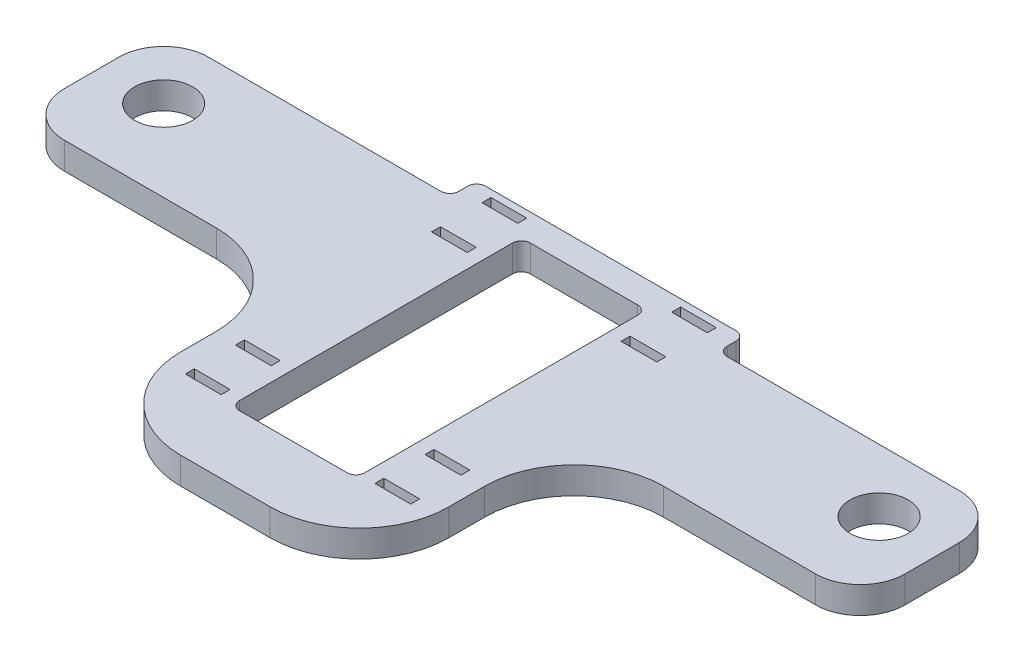
from build123d import *

# Parameters (mm, degrees)
SKETCH1_R           = 3.25
SKETCH1_W           = 14
SKETCH1_H           = 32.5
BOSS_EXTRUDE1_DEPTH = 3
FILLET1_R           = 10
FILLET2_R           = 1
FILLET3_R           = 5
CUT_EXTRUDE1_REACH  = 65.841
SKETCH2_W           = 4
SKETCH2_H           = 1


with BuildPart() as part:
    # Sketch1 → Boss-Extrude1 (new body)
    with BuildSketch(Plane(origin=(0, 0, 0), x_dir=(1, 0, 0), z_dir=(0, 1, 0))):
        Polygon((-47, 40.1), (-15, 40.1), (-15, 43.1), (15, 43.1), (15, 40.1), (47, 40.1), (47, 24), (15, 24), (15, 0), (-15, 0), (-15, 24), (-47, 24), align=None)
        with Locations(Location((40, 33.1, 0), (0, 0, 270))):
            Circle(SKETCH1_R, mode=Mode.SUBTRACT)
        with Locations(Location((-40, 33.1, 0), (0, 0, 90))):
            Circle(SKETCH1_R, mode=Mode.SUBTRACT)
        with Locations((0, 23.85)):
            Rectangle(SKETCH1_W, SKETCH1_H, mode=Mode.SUBTRACT)
    extrude(amount=BOSS_EXTRUDE1_DEPTH)

    # Fillet1
    fillet1_edges = [part.edges().sort_by_distance(p)[0] for p in [
        (-15, 1.5, -24),
        (15, 1.5, -24),
        (15, 1.5, 0),
        (-15, 1.5, 0),
    ]]
    fillet(fillet1_edges, radius=FILLET1_R)

    # Fillet2
    fillet2_edges = [part.edges().sort_by_distance(p)[0] for p in [
        (-15, 1.5, -40.1),
        (-15, 1.5, -43.1),
        (15, 1.5, -43.1),
        (15, 1.5, -40.1),
        (-7, 1.5, -40.1),
        (-7, 1.5, -7.6),
        (7, 1.5, -7.6),
        (7, 1.5, -40.1),
    ]]
    fillet(fillet2_edges, radius=FILLET2_R)

    # Fillet3
    fillet3_edges = [part.edges().sort_by_distance(p)[0] for p in [
        (-47, 1.5, -24),
        (-47, 1.5, -40.1),
        (47, 1.5, -40.1),
        (47, 1.5, -24),
    ]]
    fillet(fillet3_edges, radius=FILLET3_R)

    # Sketch2 → Cut-Extrude1 (cut, up to next)
    with BuildSketch(Plane(origin=(0, 3, 0), x_dir=(1, 0, 0), z_dir=(0, 1, 0)), mode=Mode.PRIVATE) as cut_extrude1_sk1:
        with Locations((10.6, 14.225)):
            Rectangle(SKETCH2_W, SKETCH2_H)
    cut_extrude1_tool1 = extrude(cut_extrude1_sk1.sketch, amount=-CUT_EXTRUDE1_REACH, mode=Mode.PRIVATE) & part.part
    # Sketch2 → Cut-Extrude1 (cut, up to next)
    with BuildSketch(Plane(origin=(0, 3, 0), x_dir=(1, 0, 0), z_dir=(0, 1, 0)), mode=Mode.PRIVATE) as cut_extrude1_sk2:
        with Locations((10.6, 41.8)):
            Rectangle(SKETCH2_W, SKETCH2_H)
    cut_extrude1_tool2 = extrude(cut_extrude1_sk2.sketch, amount=-CUT_EXTRUDE1_REACH, mode=Mode.PRIVATE) & part.part
    # Sketch2 → Cut-Extrude1 (cut, up to next)
    with BuildSketch(Plane(origin=(0, 3, 0), x_dir=(1, 0, 0), z_dir=(0, 1, 0)), mode=Mode.PRIVATE) as cut_extrude1_sk3:
        with Locations((-10.6, 41.8)):
            Rectangle(SKETCH2_W, SKETCH2_H)
    cut_extrude1_tool3 = extrude(cut_extrude1_sk3.sketch, amount=-CUT_EXTRUDE1_REACH, mode=Mode.PRIVATE) & part.part
    # Sketch2 → Cut-Extrude1 (cut, up to next)
    with BuildSketch(Plane(origin=(0, 3, 0), x_dir=(1, 0, 0), z_dir=(0, 1, 0)), mode=Mode.PRIVATE) as cut_extrude1_sk4:
        with Locations((-10.6, 36.15)):
            Rectangle(SKETCH2_W, SKETCH2_H)
    cut_extrude1_tool4 = extrude(cut_extrude1_sk4.sketch, amount=-CUT_EXTRUDE1_REACH, mode=Mode.PRIVATE) & part.part
    # Sketch2 → Cut-Extrude1 (cut, up to next)
    with BuildSketch(Plane(origin=(0, 3, 0), x_dir=(1, 0, 0), z_dir=(0, 1, 0)), mode=Mode.PRIVATE) as cut_extrude1_sk5:
        with Locations((10.6, 36.15)):
            Rectangle(SKETCH2_W, SKETCH2_H)
    cut_extrude1_tool5 = extrude(cut_extrude1_sk5.sketch, amount=-CUT_EXTRUDE1_REACH, mode=Mode.PRIVATE) & part.part
    # Sketch2 → Cut-Extrude1 (cut, up to next)
    with BuildSketch(Plane(origin=(0, 3, 0), x_dir=(1, 0, 0), z_dir=(0, 1, 0)), mode=Mode.PRIVATE) as cut_extrude1_sk6:
        with Locations((-10.6, 14.225)):
            Rectangle(SKETCH2_W, SKETCH2_H)
    cut_extrude1_tool6 = extrude(cut_extrude1_sk6.sketch, amount=-CUT_EXTRUDE1_REACH, mode=Mode.PRIVATE) & part.part
    # Sketch2 → Cut-Extrude1 (cut, up to next)
    with BuildSketch(Plane(origin=(0, 3, 0), x_dir=(1, 0, 0), z_dir=(0, 1, 0)), mode=Mode.PRIVATE) as cut_extrude1_sk7:
        with Locations((-10.6, 8.625)):
            Rectangle(SKETCH2_W, SKETCH2_H)
    cut_extrude1_tool7 = extrude(cut_extrude1_sk7.sketch, amount=-CUT_EXTRUDE1_REACH, mode=Mode.PRIVATE) & part.part
    # Sketch2 → Cut-Extrude1 (cut, up to next)
    with BuildSketch(Plane(origin=(0, 3, 0), x_dir=(1, 0, 0), z_dir=(0, 1, 0)), mode=Mode.PRIVATE) as cut_extrude1_sk8:
        with Locations((10.6, 8.625)):
            Rectangle(SKETCH2_W, SKETCH2_H)
    cut_extrude1_tool8 = extrude(cut_extrude1_sk8.sketch, amount=-CUT_EXTRUDE1_REACH, mode=Mode.PRIVATE) & part.part
    add(cut_extrude1_tool1.solids().sort_by_distance((10.6, 3, -14.225))[0], mode=Mode.SUBTRACT)
    add(cut_extrude1_tool2.solids().sort_by_distance((10.6, 3, -41.8))[0], mode=Mode.SUBTRACT)
    add(cut_extrude1_tool3.solids().sort_by_distance((-10.6, 3, -41.8))[0], mode=Mode.SUBTRACT)
    add(cut_extrude1_tool4.solids().sort_by_distance((-10.6, 3, -36.15))[0], mode=Mode.SUBTRACT)
    add(cut_extrude1_tool5.solids().sort_by_distance((10.6, 3, -36.15))[0], mode=Mode.SUBTRACT)
    add(cut_extrude1_tool6.solids().sort_by_distance((-10.6, 3, -14.225))[0], mode=Mode.SUBTRACT)
    add(cut_extrude1_tool7.solids().sort_by_distance((-10.6, 3, -8.625))[0], mode=Mode.SUBTRACT)
    add(cut_extrude1_tool8.solids().sort_by_distance((10.6, 3, -8.625))[0], mode=Mode.SUBTRACT)


solid = part.part
